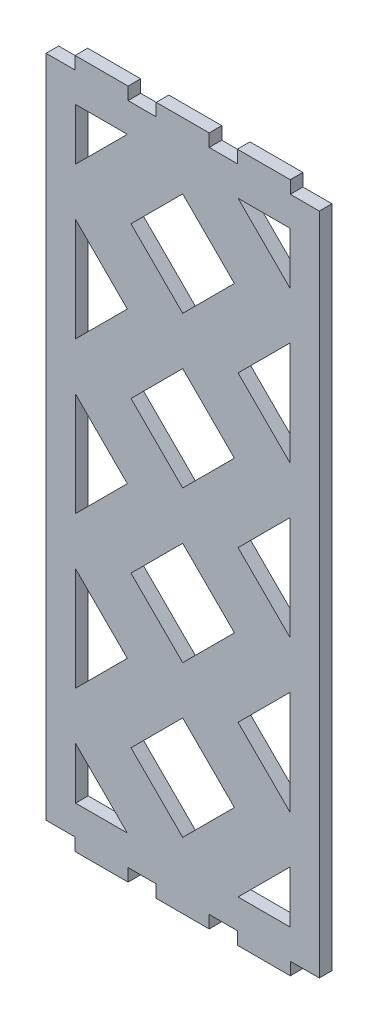
from build123d import *

# Parameters (mm, degrees)
SALIENTE_EXTRUIR1_DEPTH = 3


with BuildPart() as part:
    # Croquis2 → Saliente-Extruir1 (new body)
    with BuildSketch(Plane.XY):
        Polygon((-32.5, 0), (-25.6, 0), (-25.6, 3), (-13, 3), (-13, 0), (-6.3, 0), (-6.3, 3), (6.3, 3), (6.3, 0), (13, 0), (13, 3), (25.6, 3), (25.6, 0), (32.5, 0), (32.5, -158), (25.6, -158), (25.6, -161), (13, -161), (13, -158), (6.3, -158), (6.3, -161), (-6.3, -161), (-6.3, -158), (-13, -158), (-13, -161), (-25.6, -161), (-25.6, -158), (-32.5, -158), align=None)
        Polygon((-13.175, -7.03), (-25.475, -19.33), (-25.475, -7.03), align=None, mode=Mode.SUBTRACT)
        Polygon((13.175, -7.03), (25.475, -7.03), (25.475, -19.33), align=None, mode=Mode.SUBTRACT)
        Polygon((13.175, -79), (25.475, -66.7), (25.475, -91.3), align=None, mode=Mode.SUBTRACT)
        Polygon((13.175, -150.97), (25.475, -138.67), (25.475, -150.97), align=None, mode=Mode.SUBTRACT)
        Polygon((-13.175, -79), (-25.475, -66.7), (-25.475, -91.3), align=None, mode=Mode.SUBTRACT)
        Polygon((13.175, -43.015), (25.475, -55.315), (25.475, -30.715), align=None, mode=Mode.SUBTRACT)
        Polygon((-13.175, -43.015), (-25.475, -30.715), (-25.475, -55.315), align=None, mode=Mode.SUBTRACT)
        Polygon((0, -48.7075), (-12.3, -61.0075), (0, -73.3075), (12.3, -61.0075), align=None, mode=Mode.SUBTRACT)
        Polygon((0, -12.7225), (12.3, -25.0225), (0, -37.3225), (-12.3, -25.0225), align=None, mode=Mode.SUBTRACT)
        Polygon((-13.175, -150.97), (-25.475, -150.97), (-25.475, -138.67), align=None, mode=Mode.SUBTRACT)
        Polygon((-13.175, -114.985), (-25.475, -127.285), (-25.475, -102.685), align=None, mode=Mode.SUBTRACT)
        Polygon((-12.3, -132.9775), (0, -145.2775), (12.3, -132.9775), (0, -120.6775), align=None, mode=Mode.SUBTRACT)
        Polygon((13.175, -114.985), (25.475, -127.285), (25.475, -102.685), align=None, mode=Mode.SUBTRACT)
        Polygon((0, -84.6925), (12.3, -96.9925), (0, -109.2925), (-12.3, -96.9925), align=None, mode=Mode.SUBTRACT)
    extrude(amount=SALIENTE_EXTRUIR1_DEPTH)


solid = part.part
